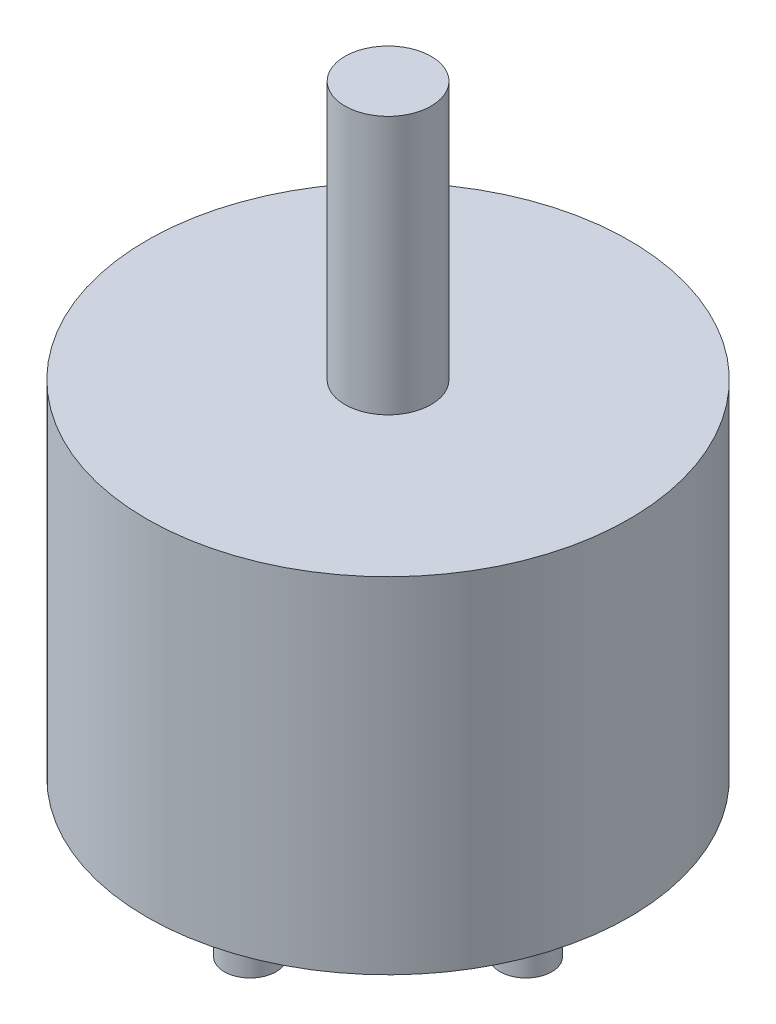
from build123d import *

# Parameters (mm, degrees)
ESQUISSE1_R        = 14
BOSS_EXTRU_1_DEPTH = 20
ESQUISSE2_R        = 2.5
BOSS_EXTRU_2_DEPTH = 15
ESQUISSE3_R        = 1.5
ESQUISSE3_R_2      = 1.438113866
BOSS_EXTRU_3_DEPTH = 5


with BuildPart() as part:
    # Esquisse1 → Boss.-Extru.1 (new body)
    with BuildSketch(Plane(origin=(0, 0, 0), x_dir=(1, 0, 0), z_dir=(0, 1, 0))):
        with Locations(Location((0, 0, 0), (0, 0, 270))):
            Circle(ESQUISSE1_R)
    extrude(amount=BOSS_EXTRU_1_DEPTH)

    # Esquisse2 → Boss.-Extru.2 (add)
    with BuildSketch(Plane(origin=(0, 20, 0), x_dir=(1, 0, 0), z_dir=(0, 1, 0))):
        with Locations(Location((0, 0, 0), (0, 0, 270))):
            Circle(ESQUISSE2_R)
    extrude(amount=BOSS_EXTRU_2_DEPTH)

    # Esquisse3 → Boss.-Extru.3 (add)
    with BuildSketch(Plane(origin=(0, 0, 0), x_dir=(-1, 0, 0), z_dir=(0, -1, 0))):
        with Locations(Location((-8, 0, 0), (0, 0, 270))):
            Circle(ESQUISSE3_R)
        with Locations(Location((0, 8, 0), (0, 0, 270))):
            Circle(ESQUISSE3_R)
        with Locations(Location((8, 0, 0), (0, 0, 270))):
            Circle(ESQUISSE3_R_2)
        with Locations(Location((0, -8, 0), (0, 0, 270))):
            Circle(ESQUISSE3_R)
    extrude(amount=BOSS_EXTRU_3_DEPTH)


solid = part.part
